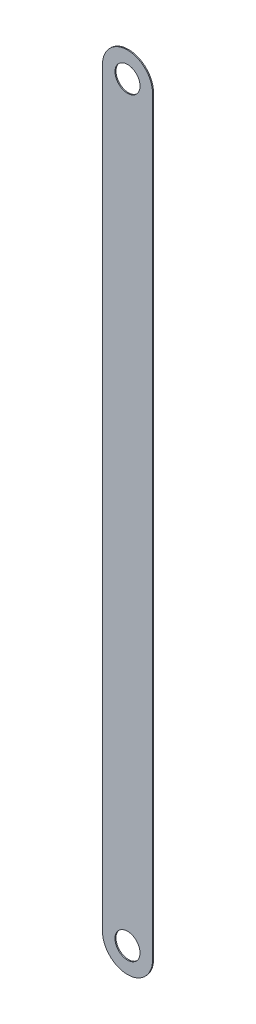
from build123d import *

# Parameters (mm, degrees)
SKETCH2_R           = 3.175
BOSS_EXTRUDE1_DEPTH = 0.254


with BuildPart() as part:
    # Sketch2 → Boss-Extrude1 (new body)
    with BuildSketch(Plane.XY):
        with BuildLine():
            Line((6.35, 190.5), (6.35, 0))
            ThreePointArc((6.35, 0), (0, -6.35), (-6.35, 0))
            Line((-6.35, 0), (-6.35, 190.5))
            ThreePointArc((-6.35, 190.5), (0, 196.85), (6.35, 190.5))
        make_face()
        with Locations((0, 190.5)):
            Circle(SKETCH2_R, mode=Mode.SUBTRACT)
        Circle(SKETCH2_R, mode=Mode.SUBTRACT)
    extrude(amount=BOSS_EXTRUDE1_DEPTH)


solid = part.part
